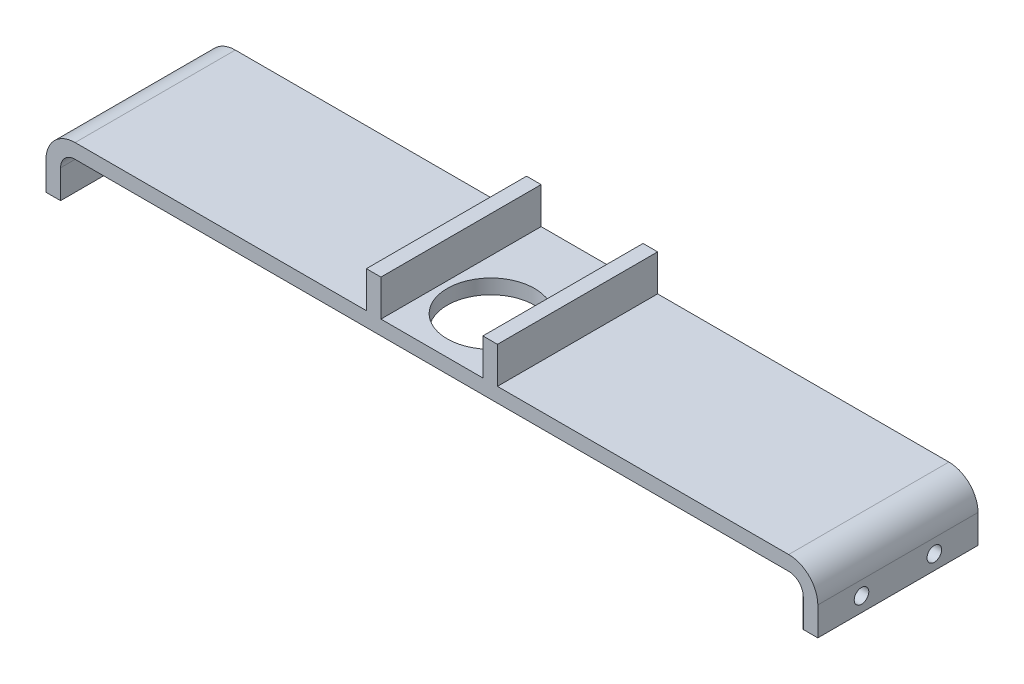
from build123d import *

# Parameters (mm, degrees)
BOSS_EXTRUDE2_DEPTH = 110
SKETCH2_R           = 5
CUT_EXTRUDE1_DEPTH  = 543.741338024
SKETCH3_W           = 10
SKETCH3_H           = 110
BOSS_EXTRUDE3_DEPTH = 25
SKETCH5_R           = 30
CUT_EXTRUDE2_DEPTH  = 543.741338024


with BuildPart() as part:
    # Sketch1 → Boss-Extrude2 (new body)
    with BuildSketch(Plane.XY):
        with BuildLine():
            Line((20, 29.6), (510, 29.6))
            ThreePointArc((510, 29.6), (517.071067812, 26.671067812), (520, 19.6))
            Line((520, 19.6), (520, 0))
            Line((520, 0), (530, 0))
            Line((530, 0), (530, 19.6))
            ThreePointArc((530, 19.6), (524.142135624, 33.742135624), (510, 39.6))
            Line((510, 39.6), (20, 39.6))
            ThreePointArc((20, 39.6), (5.857864376, 33.742135624), (0, 19.6))
            Line((0, 19.6), (0, 0))
            Line((0, 0), (10, 0))
            Line((10, 0), (10, 19.6))
            ThreePointArc((10, 19.6), (12.928932188, 26.671067812), (20, 29.6))
        make_face()
    extrude(amount=BOSS_EXTRUDE2_DEPTH)

    # Sketch2 → Cut-Extrude1 (cut, through all)
    with BuildSketch(Plane.ZY):
        with Locations((30, 10)):
            Circle(SKETCH2_R)
        with Locations(Location((80, 10, 0), (0, 0, 180))):
            Circle(SKETCH2_R)
    extrude(amount=-CUT_EXTRUDE1_DEPTH, mode=Mode.SUBTRACT)

    # Sketch3 → Boss-Extrude3 (add)
    with BuildSketch(Plane(origin=(0, 39.6, 0), x_dir=(1, 0, 0), z_dir=(0, 1, 0))):
        with Locations((225, -55)):
            Rectangle(SKETCH3_W, SKETCH3_H)
        with Locations((305, -55)):
            Rectangle(SKETCH3_W, SKETCH3_H)
    extrude(amount=BOSS_EXTRUDE3_DEPTH)

    # Sketch5 → Cut-Extrude2 (cut, through all)
    with BuildSketch(Plane(origin=(0, 39.6, 0), x_dir=(1, 0, 0), z_dir=(0, 1, 0))):
        with Locations(Location((264.500885843, -69, 0), (0, 0, 270))):
            Circle(SKETCH5_R)
    extrude(amount=-CUT_EXTRUDE2_DEPTH, mode=Mode.SUBTRACT)


solid = part.part
